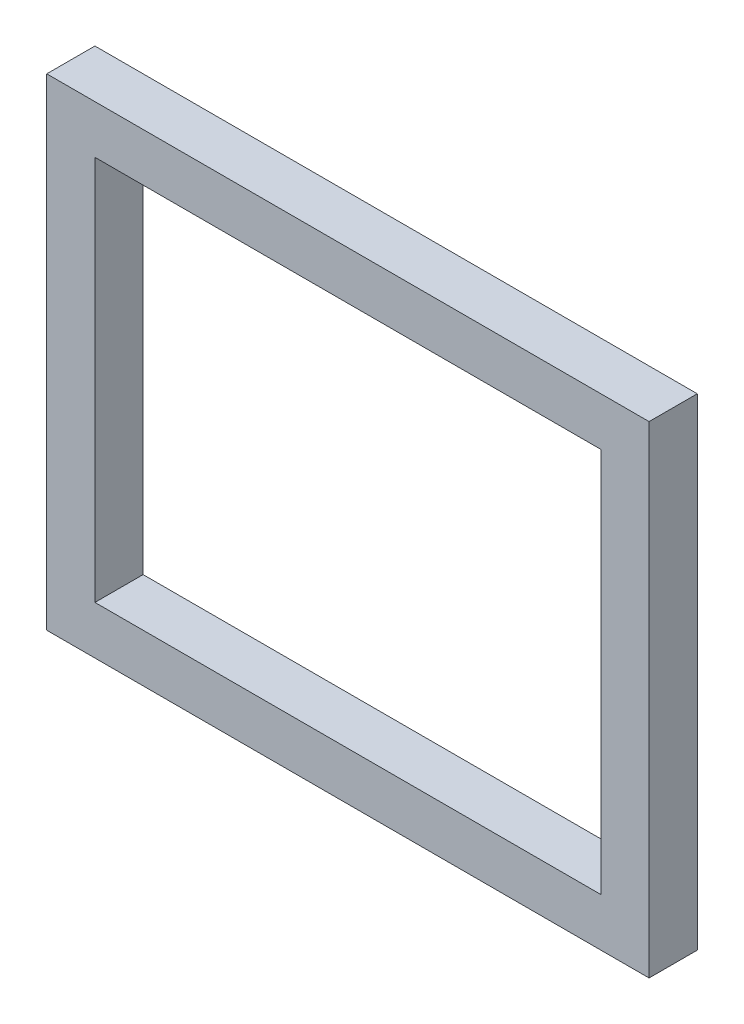
from build123d import *

# Parameters (mm, degrees)
SKETCH_1_W          = 250
SKETCH_1_H          = 200
EXTRUDE_1_DEPTH     = 20
SKETCH_2_W          = 210
SKETCH_2_H          = 160
CUT_EXTRUDE_1_DEPTH = 20


with BuildPart() as part:
    # 草图1 → 凸台-拉伸1 (new body)
    with BuildSketch(Plane.XY):
        Rectangle(SKETCH_1_W, SKETCH_1_H)
    extrude(amount=EXTRUDE_1_DEPTH)

    # 草图2 → 切除-拉伸1 (cut)
    with BuildSketch(Plane.XY.offset(20)):
        Rectangle(SKETCH_2_W, SKETCH_2_H)
    extrude(amount=-CUT_EXTRUDE_1_DEPTH, mode=Mode.SUBTRACT)


solid = part.part
